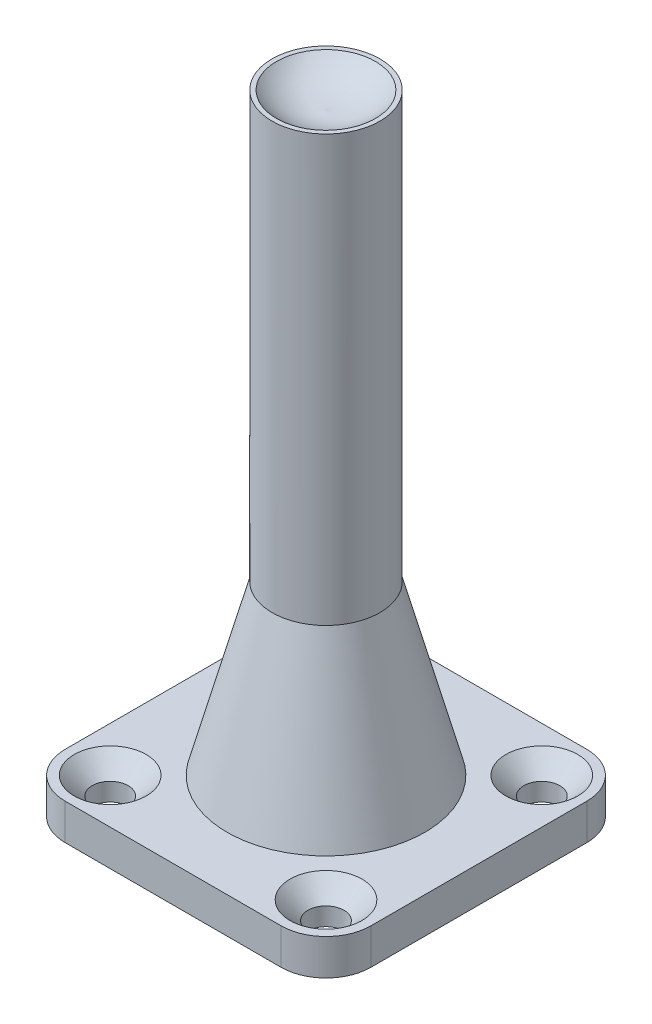
from build123d import *

# Parameters (mm, degrees)
SKETCH_1_W      = 34
SKETCH_1_H      = 34
SKETCH_1_R      = 2
EXTRUDE_1_DEPTH = 4
FILLET_1_R      = 5
SKETCH_2_R      = 6
EXTRUDE_2_DEPTH = 66
CHAMFER_1_SIZE  = 5
CHAMFER_1_SIZE2 = 18.660254038
CHAMFER_2_SIZE  = 2


with BuildPart() as part:
    # Эскиз1 → Бобышка-Вытянуть1 (new body)
    with BuildSketch(Plane(origin=(0, 0, 0), x_dir=(1, 0, 0), z_dir=(0, 1, 0))):
        Rectangle(SKETCH_1_W, SKETCH_1_H)
        with Locations(Location((-12, 12, 0), (0, 0, 270))):
            Circle(SKETCH_1_R, mode=Mode.SUBTRACT)
        with Locations(Location((12, 12, 0), (0, 0, 270))):
            Circle(SKETCH_1_R, mode=Mode.SUBTRACT)
        with Locations(Location((12, -12, 0), (0, 0, 270))):
            Circle(SKETCH_1_R, mode=Mode.SUBTRACT)
        with Locations(Location((-12, -12, 0), (0, 0, 270))):
            Circle(SKETCH_1_R, mode=Mode.SUBTRACT)
    extrude(amount=EXTRUDE_1_DEPTH)

    # Скругление1
    fillet_1_edges = [part.edges().sort_by_distance(p)[0] for p in [
        (17, 2, 17),
        (-17, 2, 17),
        (-17, 2, -17),
        (17, 2, -17),
    ]]
    fillet(fillet_1_edges, radius=FILLET_1_R)

    # Эскиз2 → Бобышка-Вытянуть2 (add)
    with BuildSketch(Plane(origin=(0, 4, 0), x_dir=(1, 0, 0), z_dir=(0, 1, 0))):
        with Locations(Location((0, 0, 0), (0, 0, 270))):
            Circle(SKETCH_2_R)
    extrude(amount=EXTRUDE_2_DEPTH)

    # Эскиз7 → Вырез-Повернуть3 (revolve, cut)
    with BuildSketch(Plane.XY):
        with BuildLine():
            Line((5.5, 70), (0, 70))
            Line((0, 70), (0, 68))
            ThreePointArc((0, 68), (2.979435889, 68.369051304), (5.5, 70))
        make_face()
    revolve(axis=Axis((0, 82.404747685, 0), (0, -1, 0)), mode=Mode.SUBTRACT)

    # Фаска1
    chamfer_1_edges = [part.edges().sort_by_distance(p)[0] for p in [
        (0, 4, -6),
    ]]
    chamfer_1_side = [part.faces().sort_by_distance(p)[0] for p in [
        (0, 4, 16.519167389),
    ]]
    chamfer(chamfer_1_edges, length=CHAMFER_1_SIZE, length2=CHAMFER_1_SIZE2, reference=chamfer_1_side[0])

    # Фаска2
    chamfer_2_edges = [part.edges().sort_by_distance(p)[0] for p in [
        (-12, 4, -14),
        (12, 4, -14),
        (12, 4, 10),
        (-12, 4, 10),
    ]]
    chamfer(chamfer_2_edges, length=CHAMFER_2_SIZE)


solid = part.part
